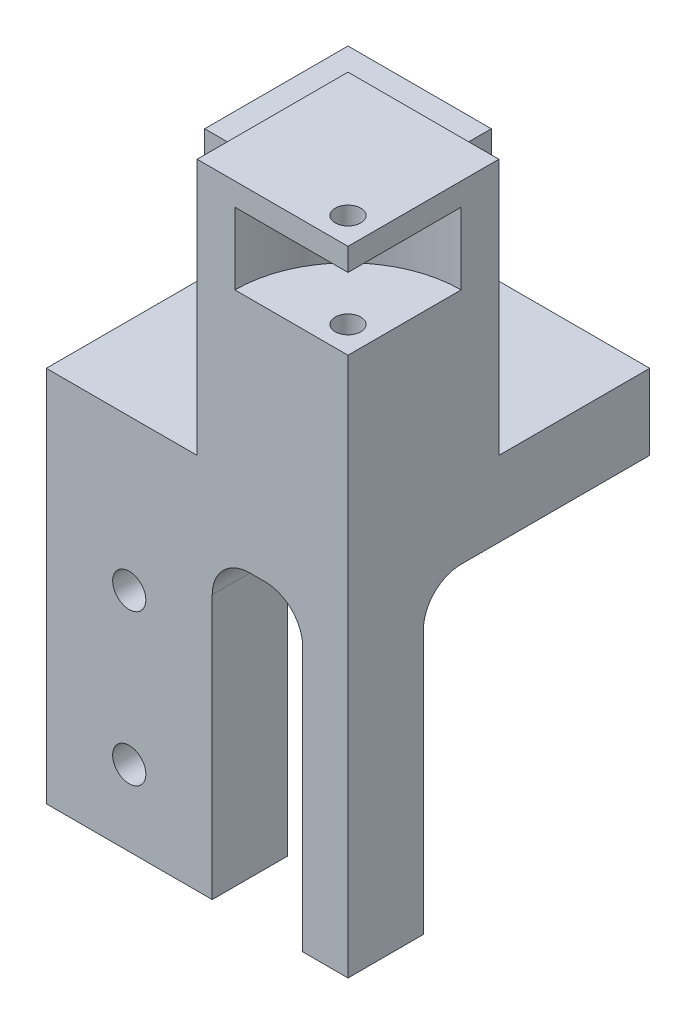
from build123d import *

# Parameters (mm, degrees)
SKETCH1_W               = 40
SKETCH1_H               = 50
BOSS_EXTRUDE1_DEPTH     = 10
SKETCH2_W               = 40
SKETCH2_H               = 10
BOSS_EXTRUDE2_DEPTH     = 30
SKETCH3_W               = 20
SKETCH3_H               = 20
BOSS_EXTRUDE3_DEPTH     = 34
SKETCH4_W               = 19
SKETCH4_H               = 19
BOSS_EXTRUDE4_DEPTH     = 17
CUT_EXTRUDE4_DEPTH      = 9.5
CUT_EXTRUDE13_DEPTH     = 9.5
CUT_EXTRUDE7_DEPTH      = 93.694591653
CUT_EXTRUDE7_DEPTH_BACK = 3
SKETCH10_R              = 1.7
CUT_EXTRUDE9_REACH      = 74.328
SKETCH12_W              = 12
SKETCH12_H              = 40
FILLET2_R               = 5
CUT_EXTRUDE10_REACH     = 74.328
SKETCH13_R              = 2.2
SKETCH14_R              = 1.7
CUT_EXTRUDE14_DEPTH     = 20


with BuildPart() as part:
    # Sketch1 → Boss-Extrude1 (new body)
    with BuildSketch(Plane.XY):
        with Locations((13.634614932, -25)):
            Rectangle(SKETCH1_W, SKETCH1_H)
    extrude(amount=BOSS_EXTRUDE1_DEPTH)

    # Sketch2 → Boss-Extrude2 (add)
    with BuildSketch(Plane.XY):
        with Locations((13.634614932, -5)):
            Rectangle(SKETCH2_W, SKETCH2_H)
    extrude(amount=-BOSS_EXTRUDE2_DEPTH)

    # Sketch3 → Boss-Extrude3 (add)
    with BuildSketch(Plane(origin=(0, 0, 0), x_dir=(1, 0, 0), z_dir=(0, 1, 0))):
        with Locations((23.634614932, 0)):
            Rectangle(SKETCH3_W, SKETCH3_H)
    extrude(amount=BOSS_EXTRUDE3_DEPTH)

    # Sketch4 → Boss-Extrude4 (add)
    with BuildSketch(Plane(origin=(0, 0, 0), x_dir=(1, 0, 0), z_dir=(0, 1, 0))):
        with Locations((3.134614932, 20.5)):
            Rectangle(SKETCH4_W, SKETCH4_H)
    extrude(amount=BOSS_EXTRUDE4_DEPTH)

    # Sketch6 → Cut-Extrude4 (cut)
    with BuildSketch(Plane(origin=(0, 31, 0), x_dir=(1, 0, 0), z_dir=(0, 1, 0))):
        with BuildLine():
            Line((33.634614932, 5), (33.634614932, -10))
            Line((33.634614932, -10), (18.634614932, -10))
            ThreePointArc((18.634614932, -10), (23.028013215, 0.606601718), (33.634614932, 5))
        make_face()
    extrude(amount=-CUT_EXTRUDE4_DEPTH, mode=Mode.SUBTRACT)

    # Sketch7 → Cut-Extrude13 (cut)
    with BuildSketch(Plane(origin=(0, 15, 0), x_dir=(1, 0, 0), z_dir=(0, 1, 0))):
        with BuildLine():
            Line((-2.365385068, 11), (12.634614932, 11))
            Line((12.634614932, 11), (12.634614932, 26))
            ThreePointArc((12.634614932, 26), (2.028013215, 21.606601718), (-2.365385068, 11))
        make_face()
    extrude(amount=-CUT_EXTRUDE13_DEPTH, mode=Mode.SUBTRACT)

    # Sketch10 → Cut-Extrude7 (cut, two sides: drawn at the far end of the back side and taken through both)
    with BuildSketch(Plane(origin=(0, 31, 0), x_dir=(-1, 0, 0), z_dir=(0, -1, 0)).offset(-CUT_EXTRUDE7_DEPTH_BACK)):
        with Locations((-30.099081026, -6.464466094)):
            Circle(SKETCH10_R)
    extrude(amount=CUT_EXTRUDE7_DEPTH + CUT_EXTRUDE7_DEPTH_BACK, mode=Mode.SUBTRACT)

    # Sketch12 → Cut-Extrude9 (cut, up to next)
    with BuildSketch(Plane.XY.offset(10), mode=Mode.PRIVATE) as cut_extrude9_sk1:
        with Locations((21.634614932, -30)):
            Rectangle(SKETCH12_W, SKETCH12_H)
    cut_extrude9_tool1 = extrude(cut_extrude9_sk1.sketch, amount=-CUT_EXTRUDE9_REACH, mode=Mode.PRIVATE) & part.part
    add(cut_extrude9_tool1.solids().sort_by_distance((21.634615, -30, 10))[0], mode=Mode.SUBTRACT)

    # Fillet2
    fillet2_edges = [part.edges().sort_by_distance(p)[0] for p in [
        (15.634614932, -10, 5),
        (27.634614932, -10, 5),
        (4.634614932, -10, 0),
        (30.634614932, -10, 0),
    ]]
    fillet(fillet2_edges, radius=FILLET2_R)

    # Sketch13 → Cut-Extrude10 (cut, up to next)
    with BuildSketch(Plane.XY.offset(10), mode=Mode.PRIVATE) as cut_extrude10_sk1:
        with Locations((4.634614932, -20)):
            Circle(SKETCH13_R)
    cut_extrude10_tool1 = extrude(cut_extrude10_sk1.sketch, amount=-CUT_EXTRUDE10_REACH, mode=Mode.PRIVATE) & part.part
    # Sketch13 → Cut-Extrude10 (cut, up to next)
    with BuildSketch(Plane.XY.offset(10), mode=Mode.PRIVATE) as cut_extrude10_sk2:
        with Locations((4.634614932, -40)):
            Circle(SKETCH13_R)
    cut_extrude10_tool2 = extrude(cut_extrude10_sk2.sketch, amount=-CUT_EXTRUDE10_REACH, mode=Mode.PRIVATE) & part.part
    add(cut_extrude10_tool1.solids().sort_by_distance((4.634615, -20, 10))[0], mode=Mode.SUBTRACT)
    add(cut_extrude10_tool2.solids().sort_by_distance((4.634615, -40, 10))[0], mode=Mode.SUBTRACT)

    # Sketch14 → Cut-Extrude14 (cut)
    with BuildSketch(Plane(origin=(0, 17, 0), x_dir=(1, 0, 0), z_dir=(0, 1, 0))):
        with Locations((9.099081026, 14.535533906)):
            Circle(SKETCH14_R)
    extrude(amount=-CUT_EXTRUDE14_DEPTH, mode=Mode.SUBTRACT)


solid = part.part
